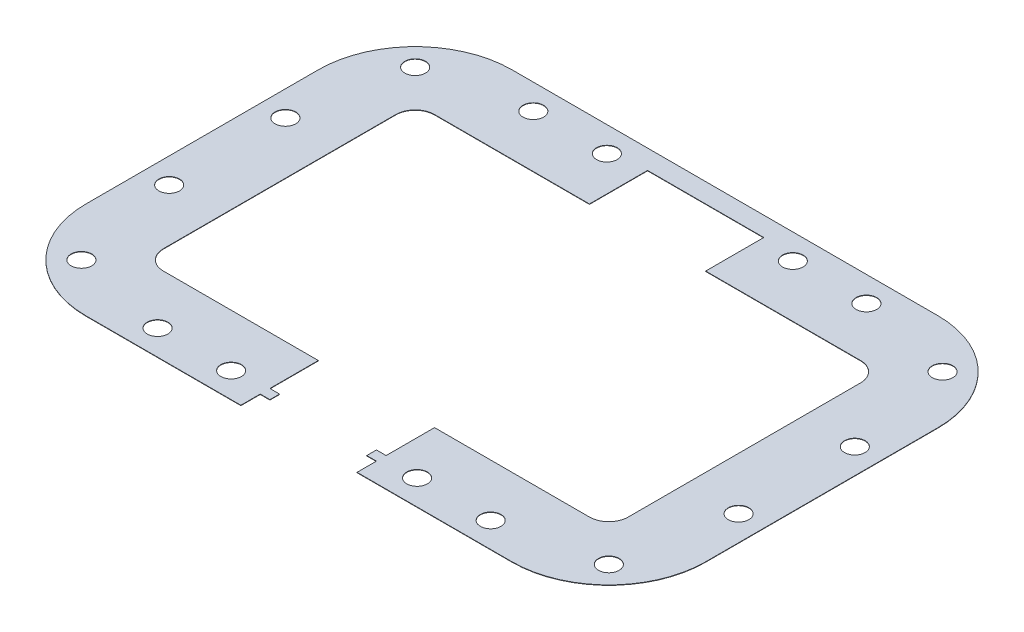
from build123d import *

# Parameters (mm, degrees)
BOSS_EXTRUDE1_DEPTH = 0.127
SKETCH2_R           = 3.3782
CUT_EXTRUDE1_DEPTH  = 124.294763186


with BuildPart() as part:
    # Sketch1 → Boss-Extrude1 (new body)
    with BuildSketch(Plane(origin=(0, 0, 0), x_dir=(1, 0, 0), z_dir=(0, 1, 0))):
        with BuildLine():
            Line((19.05, 44.45), (69.85, 44.45))
            ThreePointArc((69.85, 44.45), (74.340128061, 42.590128061), (76.2, 38.1))
            Line((76.2, 38.1), (76.2, -38.1))
            ThreePointArc((76.2, -38.1), (74.340128061, -42.590128061), (69.85, -44.45))
            Line((69.85, -44.45), (19.05, -44.45))
            Line((19.05, -44.45), (19.05, -60.325))
            Line((19.05, -60.325), (15.875, -60.325))
            Line((15.875, -60.325), (15.875, -63.5))
            Line((15.875, -63.5), (19.05, -63.5))
            Line((19.05, -63.5), (19.05, -69.85))
            Line((19.05, -69.85), (69.85, -69.85))
            ThreePointArc((69.85, -69.85), (92.300640303, -60.550640303), (101.6, -38.1))
            Line((101.6, -38.1), (101.6, 38.1))
            ThreePointArc((101.6, 38.1), (92.300640303, 60.550640303), (69.85, 69.85))
            Line((69.85, 69.85), (-69.85, 69.85))
            ThreePointArc((-69.85, 69.85), (-92.300640303, 60.550640303), (-101.6, 38.1))
            Line((-101.6, 38.1), (-101.6, -38.1))
            ThreePointArc((-101.6, -38.1), (-92.300640303, -60.550640303), (-69.85, -69.85))
            Line((-69.85, -69.85), (-19.05, -69.85))
            Line((-19.05, -69.85), (-19.05, -63.5))
            Line((-19.05, -63.5), (-15.875, -63.5))
            Line((-15.875, -63.5), (-15.875, -60.325))
            Line((-15.875, -60.325), (-19.05, -60.325))
            Line((-19.05, -60.325), (-19.05, -44.45))
            Line((-19.05, -44.45), (-69.85, -44.45))
            ThreePointArc((-69.85, -44.45), (-74.340128061, -42.590128061), (-76.2, -38.1))
            Line((-76.2, -38.1), (-76.2, 38.1))
            ThreePointArc((-76.2, 38.1), (-74.340128061, 42.590128061), (-69.85, 44.45))
            Line((-69.85, 44.45), (-19.05, 44.45))
            Line((-19.05, 44.45), (-19.05, 63.5))
            Line((-19.05, 63.5), (19.05, 63.5))
            Line((19.05, 63.5), (19.05, 44.45))
        make_face()
    extrude(amount=BOSS_EXTRUDE1_DEPTH)

    # Sketch2 → Cut-Extrude1 (cut, through all)
    with BuildSketch(Plane(origin=(0, 0.127, 0), x_dir=(1, 0, 0), z_dir=(0, 1, 0))):
        with Locations(Location((-30.48, 61.595, 0), (0, 0, 270))):
            Circle(SKETCH2_R)
        with Locations(Location((-54.61, 61.595, 0), (0, 0, 270))):
            Circle(SKETCH2_R)
        with Locations(Location((30.48, -61.595, 0), (0, 0, 90))):
            Circle(SKETCH2_R)
        with Locations(Location((54.61, -61.595, 0), (0, 0, 90))):
            Circle(SKETCH2_R)
        with Locations(Location((86.463473824, -54.713473824, 0), (0, 0, 90))):
            Circle(SKETCH2_R)
        with Locations(Location((-86.463473824, 54.713473824, 0), (0, 0, 270))):
            Circle(SKETCH2_R)
        with Locations(Location((-93.345, 19.05, 0), (0, 0, 270))):
            Circle(SKETCH2_R)
        with Locations(Location((-93.345, -19.05, 0), (0, 0, 270))):
            Circle(SKETCH2_R)
        with Locations(Location((93.345, -19.05, 0), (0, 0, 90))):
            Circle(SKETCH2_R)
        with Locations(Location((93.345, 19.05, 0), (0, 0, 90))):
            Circle(SKETCH2_R)
        with Locations(Location((86.463473824, 54.713473824, 0), (0, 0, 90))):
            Circle(SKETCH2_R)
        with Locations(Location((-86.463473824, -54.713473824, 0), (0, 0, 270))):
            Circle(SKETCH2_R)
        with Locations(Location((-54.61, -61.595, 0), (0, 0, 270))):
            Circle(SKETCH2_R)
        with Locations(Location((-30.48, -61.595, 0), (0, 0, 270))):
            Circle(SKETCH2_R)
        with Locations(Location((54.61, 61.595, 0), (0, 0, 90))):
            Circle(SKETCH2_R)
        with Locations(Location((30.48, 61.595, 0), (0, 0, 90))):
            Circle(SKETCH2_R)
    extrude(amount=-CUT_EXTRUDE1_DEPTH, mode=Mode.SUBTRACT)


solid = part.part
